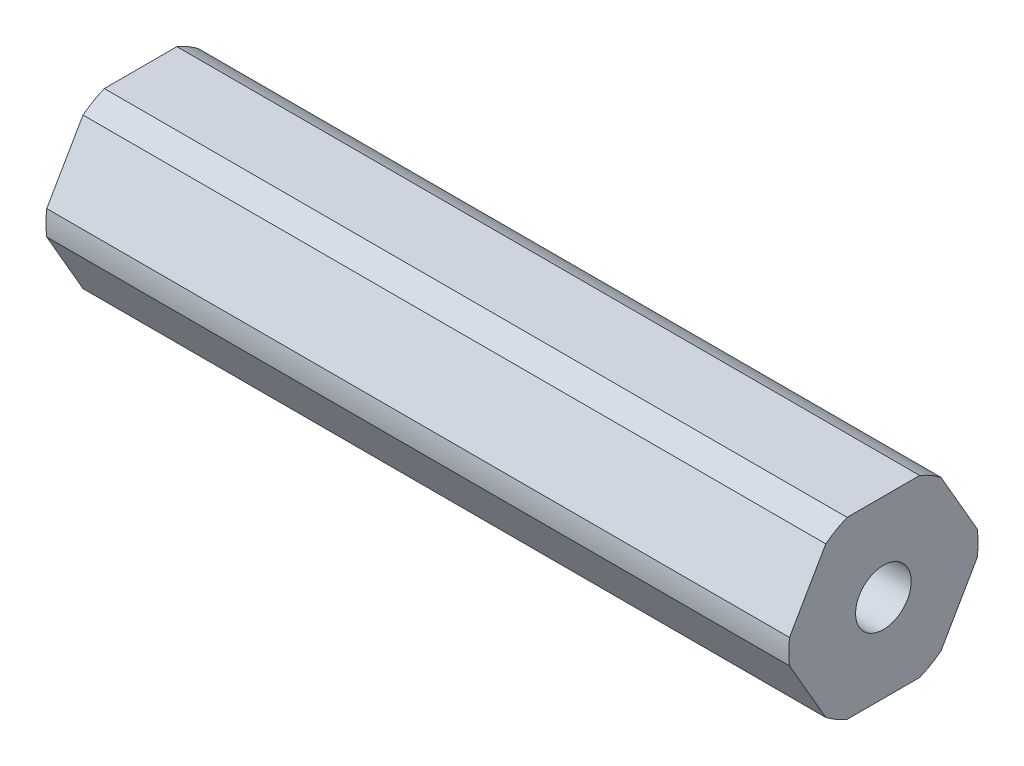
from build123d import *

# Parameters (mm, degrees)
SKETCH1_R           = 2.0193
BOSS_EXTRUDE1_DEPTH = 26.9621


with BuildPart() as part:
    # Sketch1 → Boss-Extrude1 (new, symmetric)
    with BuildSketch(Plane(origin=(0, 0, 0), x_dir=(0, 0, -1), z_dir=(1, 0, 0))):
        with BuildLine():
            ThreePointArc((6.874999966, 0), (6.860422465, 0.447468582), (6.816751782, 0.893039571))
            Line((6.816751782, 0.893039571), (4.181770846, 5.456960429))
            ThreePointArc((4.181770846, 5.456960429), (3.437499983, 5.953924622), (2.634980936, 6.35))
            Line((2.634980936, 6.35), (-2.634980936, 6.35))
            ThreePointArc((-2.634980936, 6.35), (-3.437499983, 5.953924622), (-4.181770846, 5.456960429))
            Line((-4.181770846, 5.456960429), (-6.816751782, 0.893039571))
            ThreePointArc((-6.816751782, 0.893039571), (-6.874999966, 0), (-6.816751782, -0.893039571))
            Line((-6.816751782, -0.893039571), (-4.181770846, -5.456960429))
            ThreePointArc((-4.181770846, -5.456960429), (-3.437499983, -5.953924622), (-2.634980936, -6.35))
            Line((-2.634980936, -6.35), (2.634980936, -6.35))
            ThreePointArc((2.634980936, -6.35), (3.437499983, -5.953924622), (4.181770846, -5.456960429))
            Line((4.181770846, -5.456960429), (6.816751782, -0.893039571))
            ThreePointArc((6.816751782, -0.893039571), (6.860422465, -0.447468582), (6.874999966, 0))
        make_face()
        Circle(SKETCH1_R, mode=Mode.SUBTRACT)
    extrude(amount=BOSS_EXTRUDE1_DEPTH, both=True)


solid = part.part
